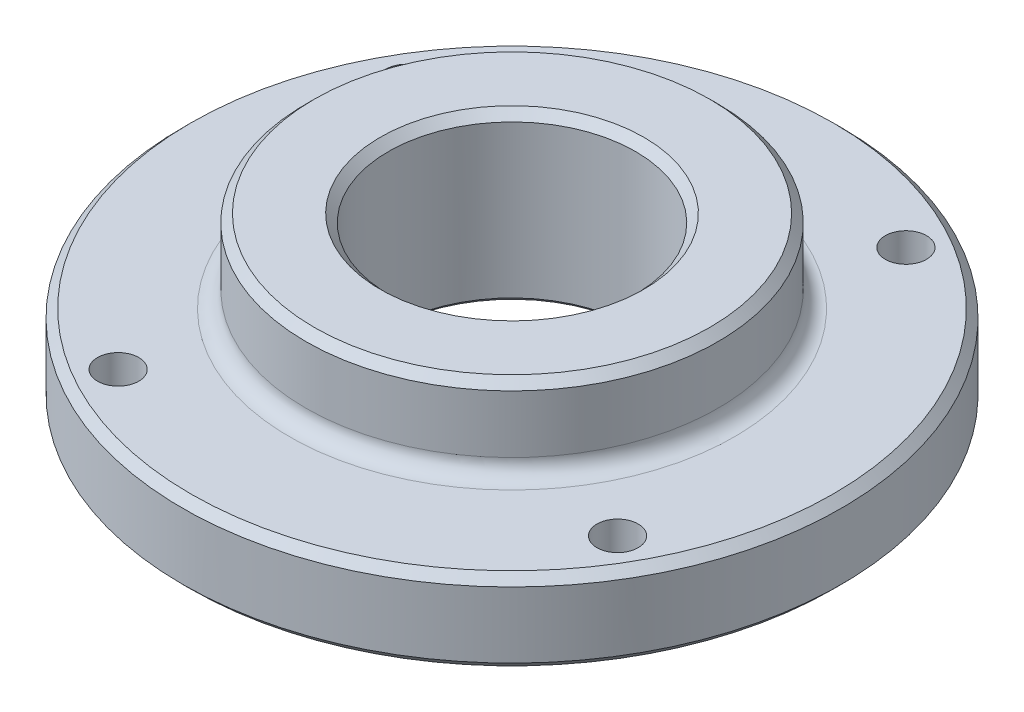
from build123d import *

# Parameters (mm, degrees)
CHAMFER1_SIZE      = 1
CUT_EXTRUDE1_REACH = 59.446
SKETCH3_R          = 2.5
FILLET1_R          = 2
CHAMFER2_SIZE      = 1
CHAMFER3_SIZE      = 0.5


with BuildPart() as part:
    # Sketch1 → Revolve1 (revolve)
    with BuildSketch(Plane.XY, mode=Mode.PRIVATE) as revolve1_sk:
        Polygon((-15, 0), (-15, 20), (-25, 20), (-25, 10), (-40, 10), (-40, 0), align=None)
    revolve(revolve1_sk.sketch.rotate(Axis((0, 0, 0), (0, 1, 0)), 270), axis=Axis((0, 0, 0), (0, 1, 0)))

    # Chamfer1
    chamfer1_edges = [part.edges().sort_by_distance(p)[0] for p in [
        (0, 20, 15),
    ]]
    chamfer(chamfer1_edges, length=CHAMFER1_SIZE)

    # Sketch3 → Cut-Extrude1 (cut, up to next)
    with BuildSketch(Plane(origin=(0, 10, 0), x_dir=(1, 0, 0), z_dir=(0, 1, 0)), mode=Mode.PRIVATE) as cut_extrude1_sk1:
        with Locations(Location((17.5, 30.310889132, 0), (0, 0, 270))):
            Circle(SKETCH3_R)
    cut_extrude1_tool1 = extrude(cut_extrude1_sk1.sketch, amount=-CUT_EXTRUDE1_REACH, mode=Mode.PRIVATE) & part.part
    # Sketch3 → Cut-Extrude1 (cut, up to next)
    with BuildSketch(Plane(origin=(0, 10, 0), x_dir=(1, 0, 0), z_dir=(0, 1, 0)), mode=Mode.PRIVATE) as cut_extrude1_sk2:
        with Locations(Location((30.310889132, -17.5, 0), (0, 0, 270))):
            Circle(SKETCH3_R)
    cut_extrude1_tool2 = extrude(cut_extrude1_sk2.sketch, amount=-CUT_EXTRUDE1_REACH, mode=Mode.PRIVATE) & part.part
    # Sketch3 → Cut-Extrude1 (cut, up to next)
    with BuildSketch(Plane(origin=(0, 10, 0), x_dir=(1, 0, 0), z_dir=(0, 1, 0)), mode=Mode.PRIVATE) as cut_extrude1_sk3:
        with Locations(Location((-17.5, -30.310889132, 0), (0, 0, 270))):
            Circle(SKETCH3_R)
    cut_extrude1_tool3 = extrude(cut_extrude1_sk3.sketch, amount=-CUT_EXTRUDE1_REACH, mode=Mode.PRIVATE) & part.part
    # Sketch3 → Cut-Extrude1 (cut, up to next)
    with BuildSketch(Plane(origin=(0, 10, 0), x_dir=(1, 0, 0), z_dir=(0, 1, 0)), mode=Mode.PRIVATE) as cut_extrude1_sk4:
        with Locations(Location((-30.310889132, 17.5, 0), (0, 0, 270))):
            Circle(SKETCH3_R)
    cut_extrude1_tool4 = extrude(cut_extrude1_sk4.sketch, amount=-CUT_EXTRUDE1_REACH, mode=Mode.PRIVATE) & part.part
    add(cut_extrude1_tool1.solids().sort_by_distance((17.5, 10, -30.310889))[0], mode=Mode.SUBTRACT)
    add(cut_extrude1_tool2.solids().sort_by_distance((30.310889, 10, 17.5))[0], mode=Mode.SUBTRACT)
    add(cut_extrude1_tool3.solids().sort_by_distance((-17.5, 10, 30.310889))[0], mode=Mode.SUBTRACT)
    add(cut_extrude1_tool4.solids().sort_by_distance((-30.310889, 10, -17.5))[0], mode=Mode.SUBTRACT)

    # Fillet1
    fillet1_edges = [part.edges().sort_by_distance(p)[0] for p in [
        (0, 10, 25),
    ]]
    fillet(fillet1_edges, radius=FILLET1_R)

    # Chamfer2
    chamfer2_edges = [part.edges().sort_by_distance(p)[0] for p in [
        (0, 0, 40),
        (0, 10, 40),
        (0, 20, 25),
    ]]
    chamfer(chamfer2_edges, length=CHAMFER2_SIZE)

    # Chamfer3
    chamfer3_edges = [part.edges().sort_by_distance(p)[0] for p in [
        (0, 0, 15),
    ]]
    chamfer(chamfer3_edges, length=CHAMFER3_SIZE)


solid = part.part
